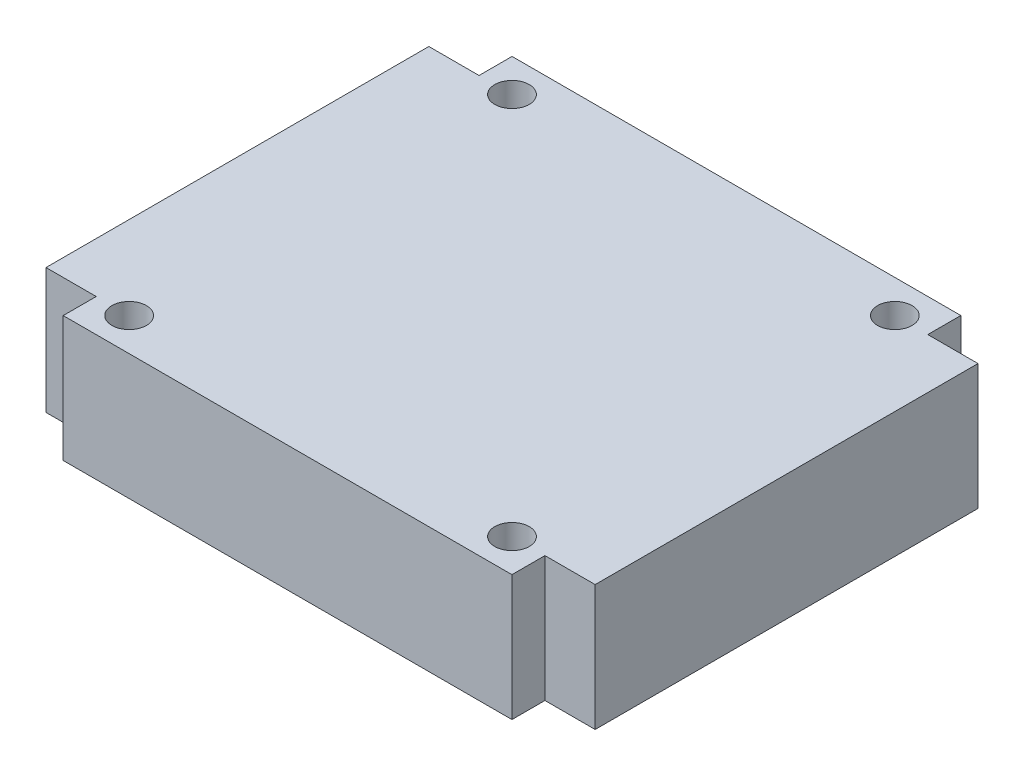
from build123d import *

# Parameters (mm, degrees)
BOSS_EXTRUDE1_DEPTH     = 10
CUT_EXTRUDE1_DEPTH      = 30.970152235
CUT_EXTRUDE1_DEPTH_BACK = 30.970152235
SKETCH1_R               = 1.375


with BuildPart() as part:
    # Sketch2 → Boss-Extrude1 (new body)
    with BuildSketch(Plane(origin=(0, 0, 0), x_dir=(1, 0, 0), z_dir=(0, 1, 0))):
        Polygon((17.875, 15.25), (21.875, 15.25), (21.875, -15.25), (17.875, -15.25), (17.875, -17.88), (-17.875, -17.88), (-17.875, -15.25), (-21.875, -15.25), (-21.875, 15.25), (-17.875, 15.25), (-17.875, 17.88), (17.875, 17.88), align=None)
    extrude(amount=BOSS_EXTRUDE1_DEPTH)

    # Sketch1 → Cut-Extrude1 (cut, two sides: drawn at the far end of the back side and taken through both)
    with BuildSketch(Plane(origin=(0, 0, 0), x_dir=(1, 0, 0), z_dir=(0, 1, 0)).offset(-CUT_EXTRUDE1_DEPTH_BACK)):
        with Locations(Location((-15.25, 15.25, 0), (0, 0, 270))):
            Circle(SKETCH1_R)
        with Locations(Location((15.25, 15.25, 0), (0, 0, 270))):
            Circle(SKETCH1_R)
        with Locations(Location((15.25, -15.25, 0), (0, 0, 270))):
            Circle(SKETCH1_R)
        with Locations(Location((-15.25, -15.25, 0), (0, 0, 270))):
            Circle(SKETCH1_R)
    extrude(amount=CUT_EXTRUDE1_DEPTH + CUT_EXTRUDE1_DEPTH_BACK, mode=Mode.SUBTRACT)


solid = part.part
